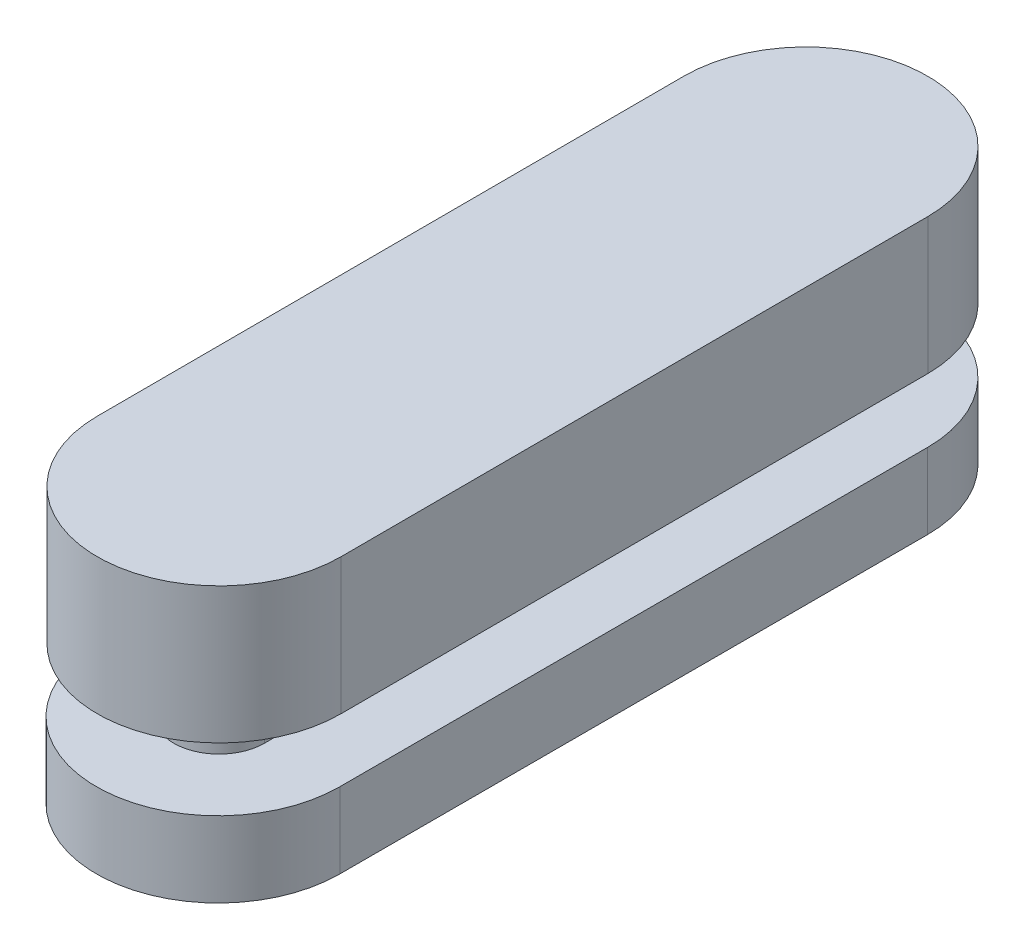
from build123d import *

# Parameters (mm, degrees)
BOSS_EXTRUDE1_DEPTH = 4.5
BOSS_EXTRUDE2_DEPTH = 3.8
BOSS_EXTRUDE3_DEPTH = 8.1


with BuildPart() as part:
    # Sketch1 → Boss-Extrude1 (new body)
    with BuildSketch(Plane(origin=(0, 0, 0), x_dir=(1, 0, 0), z_dir=(0, 1, 0))):
        with BuildLine():
            Line((7.25, 0), (7.25, -35))
            ThreePointArc((7.25, -35), (0, -42.25), (-7.25, -35))
            Line((-7.25, -35), (-7.25, 0))
            ThreePointArc((-7.25, 0), (0, 7.25), (7.25, 0))
        make_face()
    extrude(amount=BOSS_EXTRUDE1_DEPTH)

    # Sketch3 → Boss-Extrude2 (add)
    with BuildSketch(Plane(origin=(0, 4.5, 0), x_dir=(1, 0, 0), z_dir=(0, 1, 0))):
        with BuildLine():
            Line((-2.622571491, -0.457666807), (-2.622571491, -0.011296081))
            Line((-2.622571491, -0.011296081), (2.763792269, -0.011296081))
            Line((2.763792269, -0.011296081), (2.763792269, -0.457666807))
            ThreePointArc((2.763792269, -0.457666807), (2.791332039, -0.235236185), (2.800532634, -0.011296081))
            ThreePointArc((2.800532634, -0.011296081), (-0.153329714, 2.709425568), (-2.622571491, -0.457666807))
        make_face()
        with BuildLine():
            Line((2.763792269, -0.011296081), (-2.622571491, -0.011296081))
            Line((-2.622571491, -0.011296081), (-2.622571491, -0.457666807))
            ThreePointArc((-2.622571491, -0.457666807), (0.070610389, -2.741218326), (2.763792269, -0.457666807))
            Line((2.763792269, -0.457666807), (2.763792269, -0.011296081))
        make_face()
        with BuildLine():
            ThreePointArc((2.763792269, -0.457666807), (0.070610389, -2.741218326), (-2.622571491, -0.457666807))
            Line((-2.622571491, -0.457666807), (-2.622571491, -35.011296081))
            ThreePointArc((-2.622571491, -35.011296081), (0.070610389, -32.318114201), (2.763792269, -35.011296081))
            Line((2.763792269, -35.011296081), (2.763792269, -0.457666807))
        make_face()
        with BuildLine():
            ThreePointArc((2.763792269, -35.011296081), (0.070610389, -32.318114201), (-2.622571491, -35.011296081))
            Line((-2.622571491, -35.011296081), (2.763792269, -35.011296081))
        make_face()
        with BuildLine():
            Line((2.763792269, -35.011296081), (-2.622571491, -35.011296081))
            ThreePointArc((-2.622571491, -35.011296081), (0.070610389, -37.704477961), (2.763792269, -35.011296081))
        make_face()
    extrude(amount=BOSS_EXTRUDE2_DEPTH)

    # Sketch4 → Boss-Extrude3 (add)
    with BuildSketch(Plane(origin=(0, 8.3, 0), x_dir=(1, 0, 0), z_dir=(0, 1, 0))):
        with BuildLine():
            Line((7.25308141, 0.014627933), (7.323691799, -34.996668148))
            ThreePointArc((7.323691799, -34.996668148), (0.085238322, -42.264377491), (-7.182471021, -35.025924014))
            Line((-7.182471021, -35.025924014), (-7.25308141, -0.014627933))
            ThreePointArc((-7.25308141, -0.014627933), (-0.014627933, 7.25308141), (7.25308141, 0.014627933))
        make_face()
    extrude(amount=BOSS_EXTRUDE3_DEPTH)


solid = part.part
